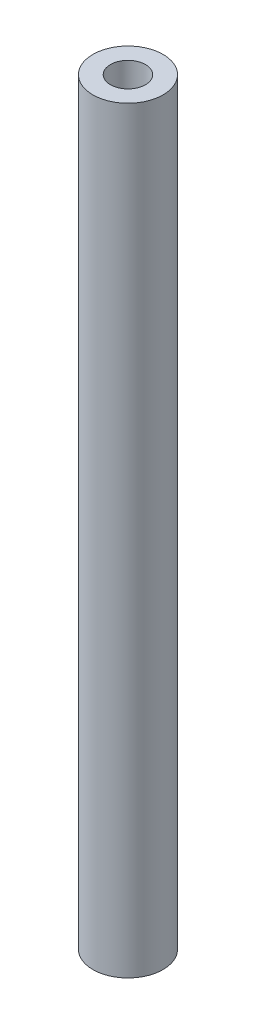
from build123d import *

# Parameters (mm, degrees)
CROQUIS1_R              = 5
SALIENTE_EXTRUIR1_DEPTH = 108
CROQUIS2_R              = 2.5
CORTAR_EXTRUIR1_DEPTH   = 10


with BuildPart() as part:
    # Croquis1 → Saliente-Extruir1 (new body)
    with BuildSketch(Plane(origin=(0, 0, 0), x_dir=(1, 0, 0), z_dir=(0, 1, 0))):
        with Locations(Location((0, 0, 0), (0, 0, 270))):
            Circle(CROQUIS1_R)
    extrude(amount=SALIENTE_EXTRUIR1_DEPTH)

    # Croquis2 → Cortar-Extruir1 (cut)
    with BuildSketch(Plane.XZ):
        with Locations(Location((0, 0, 0), (0, 0, 270))):
            Circle(CROQUIS2_R)
    cortar_extruir1 = extrude(amount=-CORTAR_EXTRUIR1_DEPTH, mode=Mode.SUBTRACT)

    # Simetría1: Cortar-Extruir1 across plane
    add(cortar_extruir1.mirror(Plane(origin=(0, 54, 0), x_dir=(0, 0, 1), z_dir=(0, -1, 0))), mode=Mode.SUBTRACT)


solid = part.part
